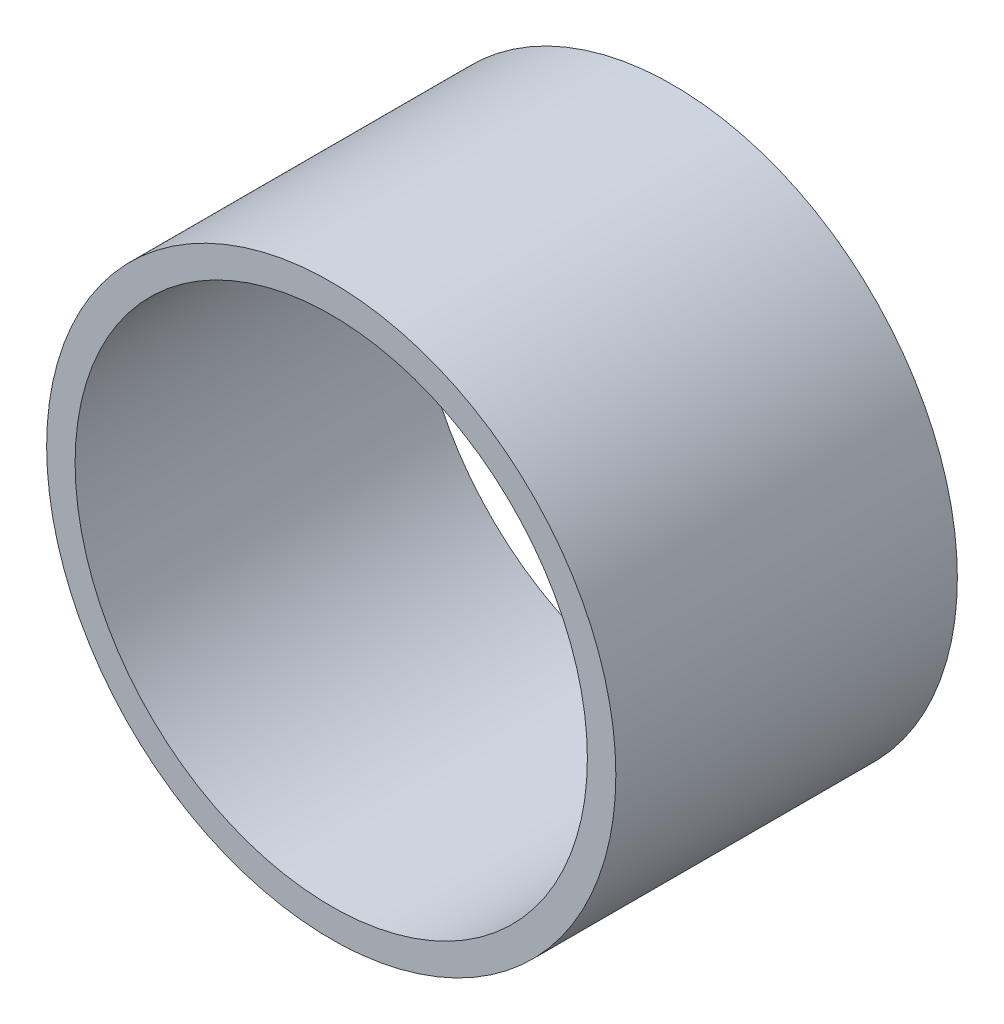
from build123d import *

# Parameters (mm, degrees)
ESQUISSE1_R        = 25
ESQUISSE1_R_2      = 22.5
BOSS_EXTRU_1_DEPTH = 30


with BuildPart() as part:
    # Esquisse1 → Boss.-Extru.1 (new body)
    with BuildSketch(Plane.XY):
        Circle(ESQUISSE1_R)
        Circle(ESQUISSE1_R_2, mode=Mode.SUBTRACT)
    extrude(amount=BOSS_EXTRU_1_DEPTH)


solid = part.part
